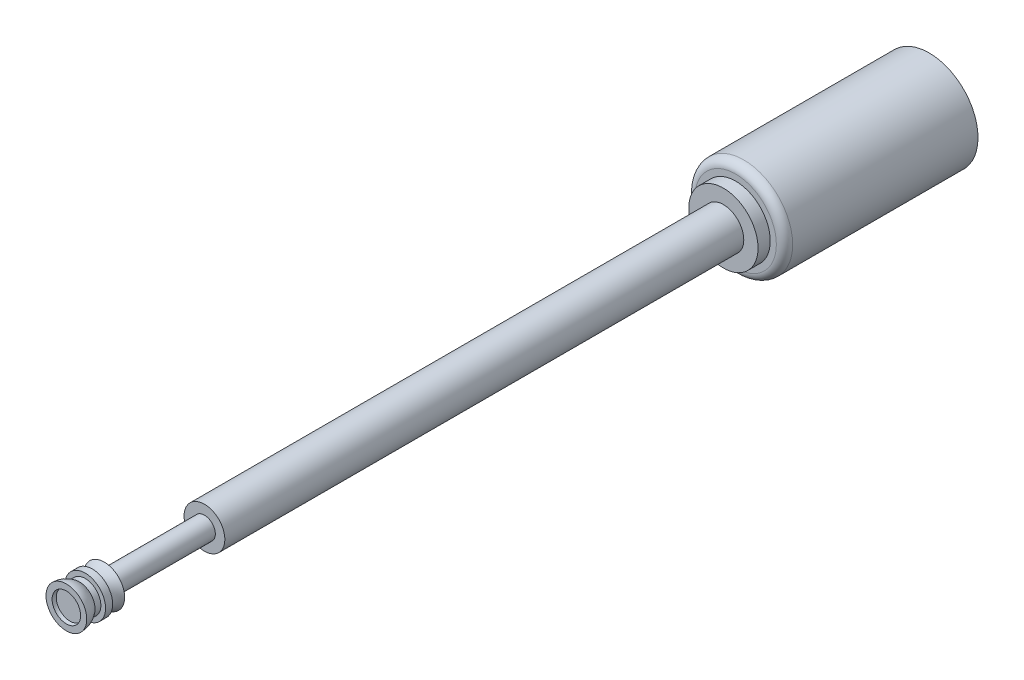
from build123d import *

# Parameters (mm, degrees)
SKETCH1_R           = 0.5
BOSS_EXTRUDE1_DEPTH = 15.5
SKETCH1_3_R         = 1.2
SKETCH1_3_R_2       = 0.5
BOSS_EXTRUDE2_DEPTH = 4.75
FILLET1_R           = 0.2
SKETCH2_R           = 0.85
BOSS_EXTRUDE3_DEPTH = 0.3
SKETCH4_W           = 0.471869861
SKETCH4_H           = 0.036263573
SKETCH5_W           = 0.976937104
SKETCH5_H           = 2.46
SKETCH6_R           = 0.5
BOSS_EXTRUDE5_DEPTH = 0.3


with BuildPart() as part:
    # Sketch1 → Boss-Extrude1 (new body)
    with BuildSketch(Plane.XY):
        Circle(SKETCH1_R)
    extrude(amount=BOSS_EXTRUDE1_DEPTH)



with BuildPart() as body_2:
    # Sketch1<3> → Boss-Extrude2 (new body)
    with BuildSketch(Plane.XY):
        Circle(SKETCH1_3_R)
        Circle(SKETCH1_3_R_2, mode=Mode.SUBTRACT)
    extrude(amount=-BOSS_EXTRUDE2_DEPTH)

    # Fillet1
    fillet1_edges = [body_2.edges().sort_by_distance(p)[0] for p in [
        (-1.2, 0, 0),
    ]]
    fillet(fillet1_edges, radius=FILLET1_R)


with BuildPart() as part_1:
    add(part.part)

    add(body_2.part)  # Boss-Extrude3 merges body 2
    # Sketch2 → Boss-Extrude3 (add)
    with BuildSketch(Plane.XY):
        Circle(SKETCH2_R)
    extrude(amount=BOSS_EXTRUDE3_DEPTH)

    # Sketch3 → Revolve1 (revolve)
    with BuildSketch(Plane(origin=(0, 0, 0), x_dir=(1, 0, 0), z_dir=(0, 1, 0))):
        with BuildLine():
            Line((0.5, -15.5), (0, -15.5))
            Line((0, -15.5), (0, -16.08))
            ThreePointArc((0, -16.08), (0.247487373, -16.182512627), (0.35, -16.43))
            Line((0.35, -16.43), (0.5, -16.43))
            ThreePointArc((0.5, -16.43), (0.470461057, -16.26068847), (0.385334423, -16.111382075))
            Line((0.385334423, -16.111382075), (0.385334423, -15.967978567))
            Line((0.385334423, -15.967978567), (0.5, -15.967978567))
            Line((0.5, -15.967978567), (0.5, -15.793310987))
            Line((0.5, -15.793310987), (0.416056351, -15.793310987))
            ThreePointArc((0.416056351, -15.793310987), (0.437455238, -15.640767656), (0.5, -15.5))
        make_face()
    revolve(axis=Axis((0, 0, 15.5), (0, 0, 1)))

    # Sketch4 → Revolve2 (revolve)
    with BuildSketch(Plane(origin=(0, 0, 0), x_dir=(1, 0, 0), z_dir=(0, 1, 0))):
        with Locations((-0.235934931, -16.321868214)):
            Rectangle(SKETCH4_W, SKETCH4_H)
    revolve(axis=Axis((0, 0, 15.5), (0, 0, 1)))

    # Sketch5 → Cut-Revolve1 (revolve, cut)
    with BuildSketch(Plane(origin=(0, 0, 0), x_dir=(1, 0, 0), z_dir=(0, 1, 0))):
        with Locations((-0.755461177, -14.27)):
            Rectangle(SKETCH5_W, SKETCH5_H)
    revolve(axis=Axis((0, 0, 15.5), (0, 0, 1)), mode=Mode.SUBTRACT)

    # Sketch6 → Boss-Extrude5 (add)
    with BuildSketch(Plane(origin=(0, 0, -4.75), x_dir=(-1, 0, 0), z_dir=(0, 0, -1))):
        Circle(SKETCH6_R)
    extrude(amount=-BOSS_EXTRUDE5_DEPTH)


solid = part_1.part
